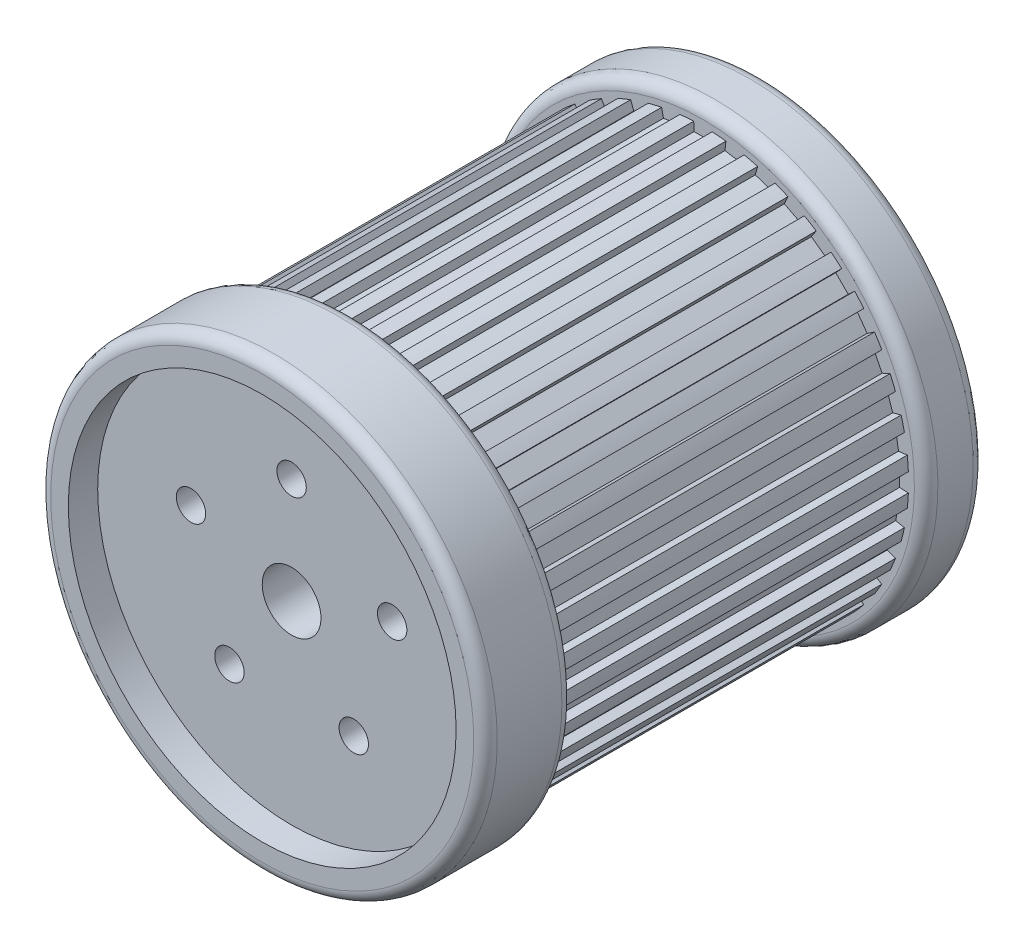
from build123d import *

# Parameters (mm, degrees)
SKETCH2_R           = 5
SKETCH2_R_2         = 2.5
CUT_EXTRUDE1_DEPTH  = 86.732140997
CUT_EXTRUDE2_DEPTH  = 70
BOSS_EXTRUDE1_START = -10
SKETCH4_R           = 38
SKETCH4_R_2         = 35
BOSS_EXTRUDE1_DEPTH = 10
CIRPATTERN1_COUNT   = 40
SKETCH5_R           = 38
SKETCH5_R_2         = 33
BOSS_EXTRUDE2_DEPTH = 5
SKETCH6_R           = 38
SKETCH6_R_2         = 32
BOSS_EXTRUDE3_DEPTH = 10
FILLET1_R           = 3
FILLET2_R           = 2


with BuildPart() as part:
    # Sketch1 → Revolve1 (revolve)
    with BuildSketch(Plane(origin=(0, 0, 0), x_dir=(0, 0, -1), z_dir=(1, 0, 0)), mode=Mode.PRIVATE) as revolve1_sk:
        Polygon((-27.103174603, 0), (-37.103174603, 0), (-37.103174603, -35), (42.896825397, -35), (42.896825397, -25), (-27.103174603, -25), align=None)
    revolve(revolve1_sk.sketch.rotate(Axis((0, 0, 27.103174603), (0, 0, 1)), 180), axis=Axis((0, 0, 27.103174603), (0, 0, 1)))

    # Sketch2 → Cut-Extrude1 (cut, through all)
    with BuildSketch(Plane(origin=(0, 0, 27.103174603), x_dir=(-1, 0, 0), z_dir=(0, 0, -1))):
        with Locations(Location((0, 0, 0), (0, 0, 90))):
            Circle(SKETCH2_R)
        with Locations(Location((0, 18, 0), (0, 0, 90))):
            Circle(SKETCH2_R_2)
        with Locations(Location((17.119017293, 5.562305899, 0), (0, 0, 90))):
            Circle(SKETCH2_R_2)
        with Locations(Location((10.580134541, -14.562305899, 0), (0, 0, 90))):
            Circle(SKETCH2_R_2)
        with Locations(Location((-10.580134541, -14.562305899, 0), (0, 0, 90))):
            Circle(SKETCH2_R_2)
        with Locations(Location((-17.119017293, 5.562305899, 0), (0, 0, 90))):
            Circle(SKETCH2_R_2)
    extrude(amount=-CUT_EXTRUDE1_DEPTH, mode=Mode.SUBTRACT)

    # Sketch3 → Cut-Extrude2 (cut)
    with BuildSketch(Plane(origin=(0, 0, -42.896825397), x_dir=(-1, 0, 0), z_dir=(0, 0, -1))):
        with BuildLine():
            Line((-1.5, 33.466401061), (1.5, 33.466401061))
            Line((1.5, 33.466401061), (1.567164179, 34.964896631))
            ThreePointArc((1.567164179, 34.964896631), (0, 35), (-1.567164179, 34.964896631))
            Line((-1.567164179, 34.964896631), (-1.5, 33.466401061))
        make_face()
    cut_extrude2 = extrude(amount=-CUT_EXTRUDE2_DEPTH, mode=Mode.SUBTRACT)

    # Sketch4 → Boss-Extrude1 (add)
    with BuildSketch(Plane.XY.offset(37.103174603).offset(BOSS_EXTRUDE1_START)):
        Circle(SKETCH4_R)
        Circle(SKETCH4_R_2, mode=Mode.SUBTRACT)
    extrude(amount=BOSS_EXTRUDE1_DEPTH)

    # CirPattern1: Cut-Extrude2 ×40 about axis
    cirpattern1_axis = Axis((0, 0, 0), (0, 0, 1))
    for i in range(1, CIRPATTERN1_COUNT):
        add(cut_extrude2.rotate(cirpattern1_axis, i * 360 / CIRPATTERN1_COUNT), mode=Mode.SUBTRACT)

    # Sketch5 → Boss-Extrude2 (add)
    with BuildSketch(Plane.XY.offset(37.103174603)):
        Circle(SKETCH5_R)
        Circle(SKETCH5_R_2, mode=Mode.SUBTRACT)
    extrude(amount=BOSS_EXTRUDE2_DEPTH)

    # Sketch6 → Boss-Extrude3 (add)
    with BuildSketch(Plane(origin=(0, 0, -42.896825397), x_dir=(-1, 0, 0), z_dir=(0, 0, -1))):
        with Locations(Location((0, 0, 0), (0, 0, 180))):
            Circle(SKETCH6_R)
        Circle(SKETCH6_R_2, mode=Mode.SUBTRACT)
    extrude(amount=-BOSS_EXTRUDE3_DEPTH)

    # Fillet1
    fillet1_edges = [part.edges().sort_by_distance(p)[0] for p in [
        (0, -25, -42.896825397),
    ]]
    fillet(fillet1_edges, radius=FILLET1_R)

    # Fillet2
    fillet2_edges = [part.edges().sort_by_distance(p)[0] for p in [
        (-38, 0, 27.103174603),
        (-38, 0, 42.103174603),
        (-38, 0, -42.896825397),
        (-38, 0, -32.896825397),
    ]]
    fillet(fillet2_edges, radius=FILLET2_R)


solid = part.part
